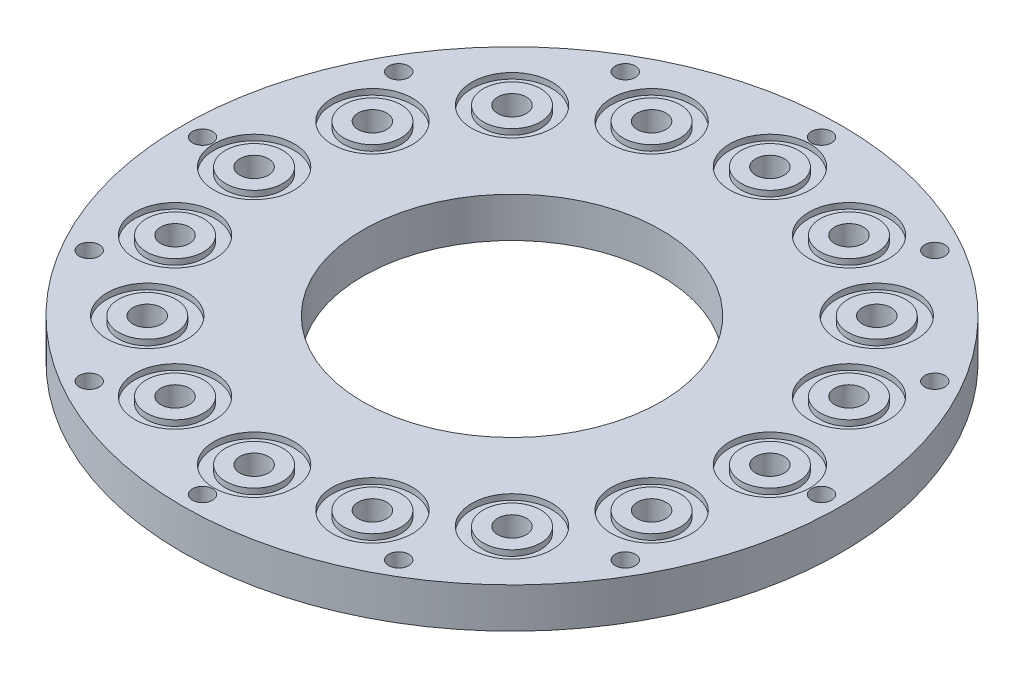
from build123d import *

# Parameters (mm, degrees)
SKETCH1_R           = 57.5
SKETCH1_R_2         = 1.75
SKETCH1_R_3         = 26
SKETCH1_R_4         = 2.5
BOSS_EXTRUDE1_DEPTH = 7
SKETCH2_R           = 7
SKETCH2_R_2         = 5
CUT_EXTRUDE1_DEPTH  = 1


with BuildPart() as part:
    # Sketch1 → Boss-Extrude1 (new body)
    with BuildSketch(Plane(origin=(0, 0, 0), x_dir=(1, 0, 0), z_dir=(0, 1, 0))):
        with Locations(Location((0, 0, 0), (0, 0, 270))):
            Circle(SKETCH1_R)
        with Locations(Location((0, 54, 0), (0, 0, 270))):
            Circle(SKETCH1_R_2, mode=Mode.SUBTRACT)
        with Locations(Location((27, 46.765371804, 0), (0, 0, 270))):
            Circle(SKETCH1_R_2, mode=Mode.SUBTRACT)
        with Locations(Location((46.765371804, 27, 0), (0, 0, 270))):
            Circle(SKETCH1_R_2, mode=Mode.SUBTRACT)
        with Locations(Location((54, 0, 0), (0, 0, 270))):
            Circle(SKETCH1_R_2, mode=Mode.SUBTRACT)
        with Locations(Location((46.765371804, -27, 0), (0, 0, 270))):
            Circle(SKETCH1_R_2, mode=Mode.SUBTRACT)
        with Locations(Location((27, -46.765371804, 0), (0, 0, 270))):
            Circle(SKETCH1_R_2, mode=Mode.SUBTRACT)
        with Locations(Location((0, -54, 0), (0, 0, 270))):
            Circle(SKETCH1_R_2, mode=Mode.SUBTRACT)
        with Locations(Location((-27, -46.765371804, 0), (0, 0, 270))):
            Circle(SKETCH1_R_2, mode=Mode.SUBTRACT)
        with Locations(Location((-46.765371804, -27, 0), (0, 0, 270))):
            Circle(SKETCH1_R_2, mode=Mode.SUBTRACT)
        with Locations(Location((-54, 0, 0), (0, 0, 270))):
            Circle(SKETCH1_R_2, mode=Mode.SUBTRACT)
        with Locations(Location((-46.765371804, 27, 0), (0, 0, 270))):
            Circle(SKETCH1_R_2, mode=Mode.SUBTRACT)
        with Locations(Location((-27, 46.765371804, 0), (0, 0, 270))):
            Circle(SKETCH1_R_2, mode=Mode.SUBTRACT)
        with Locations(Location((0, 0, 0), (0, 0, 270))):
            Circle(SKETCH1_R_3, mode=Mode.SUBTRACT)
        with Locations(Location((0, 45, 0), (0, 0, 270))):
            Circle(SKETCH1_R_4, mode=Mode.SUBTRACT)
        with Locations(Location((17.220754456, 41.574578963, 0), (0, 0, 270))):
            Circle(SKETCH1_R_4, mode=Mode.SUBTRACT)
        with Locations(Location((31.819805153, 31.819805153, 0), (0, 0, 270))):
            Circle(SKETCH1_R_4, mode=Mode.SUBTRACT)
        with Locations(Location((41.574578963, 17.220754456, 0), (0, 0, 270))):
            Circle(SKETCH1_R_4, mode=Mode.SUBTRACT)
        with Locations(Location((45, 0, 0), (0, 0, 270))):
            Circle(SKETCH1_R_4, mode=Mode.SUBTRACT)
        with Locations(Location((41.574578963, -17.220754456, 0), (0, 0, 270))):
            Circle(SKETCH1_R_4, mode=Mode.SUBTRACT)
        with Locations(Location((31.819805153, -31.819805153, 0), (0, 0, 270))):
            Circle(SKETCH1_R_4, mode=Mode.SUBTRACT)
        with Locations(Location((17.220754456, -41.574578963, 0), (0, 0, 270))):
            Circle(SKETCH1_R_4, mode=Mode.SUBTRACT)
        with Locations(Location((0, -45, 0), (0, 0, 270))):
            Circle(SKETCH1_R_4, mode=Mode.SUBTRACT)
        with Locations(Location((-17.220754456, -41.574578963, 0), (0, 0, 270))):
            Circle(SKETCH1_R_4, mode=Mode.SUBTRACT)
        with Locations(Location((-31.819805153, -31.819805153, 0), (0, 0, 270))):
            Circle(SKETCH1_R_4, mode=Mode.SUBTRACT)
        with Locations(Location((-41.574578963, -17.220754456, 0), (0, 0, 270))):
            Circle(SKETCH1_R_4, mode=Mode.SUBTRACT)
        with Locations(Location((-45, 0, 0), (0, 0, 270))):
            Circle(SKETCH1_R_4, mode=Mode.SUBTRACT)
        with Locations(Location((-41.574578963, 17.220754456, 0), (0, 0, 270))):
            Circle(SKETCH1_R_4, mode=Mode.SUBTRACT)
        with Locations(Location((-31.819805153, 31.819805153, 0), (0, 0, 270))):
            Circle(SKETCH1_R_4, mode=Mode.SUBTRACT)
        with Locations(Location((-17.220754456, 41.574578963, 0), (0, 0, 270))):
            Circle(SKETCH1_R_4, mode=Mode.SUBTRACT)
    extrude(amount=BOSS_EXTRUDE1_DEPTH)

    # Sketch2 → Cut-Extrude1 (cut)
    # profile 1 of 16: a face of its own
    with BuildSketch(Plane(origin=(0, 7, 0), x_dir=(1, 0, 0), z_dir=(0, 1, 0))):
        with Locations(Location((0, 45, 0), (0, 0, 270))):
            Circle(SKETCH2_R)
        with Locations(Location((0, 45, 0), (0, 0, 270))):
            Circle(SKETCH2_R_2, mode=Mode.SUBTRACT)
    # profile 2 of 16: a face of its own
    with BuildSketch(Plane(origin=(0, 7, 0), x_dir=(1, 0, 0), z_dir=(0, 1, 0))):
        with Locations(Location((17.220754456, 41.574578963, 0), (0, 0, 270))):
            Circle(SKETCH2_R)
        with Locations(Location((17.220754456, 41.574578963, 0), (0, 0, 270))):
            Circle(SKETCH2_R_2, mode=Mode.SUBTRACT)
    # profile 3 of 16: a face of its own
    with BuildSketch(Plane(origin=(0, 7, 0), x_dir=(1, 0, 0), z_dir=(0, 1, 0))):
        with Locations(Location((31.819805153, 31.819805153, 0), (0, 0, 270))):
            Circle(SKETCH2_R)
        with Locations(Location((31.819805153, 31.819805153, 0), (0, 0, 270))):
            Circle(SKETCH2_R_2, mode=Mode.SUBTRACT)
    # profile 4 of 16: a face of its own
    with BuildSketch(Plane(origin=(0, 7, 0), x_dir=(1, 0, 0), z_dir=(0, 1, 0))):
        with Locations(Location((41.574578963, 17.220754456, 0), (0, 0, 270))):
            Circle(SKETCH2_R)
        with Locations(Location((41.574578963, 17.220754456, 0), (0, 0, 270))):
            Circle(SKETCH2_R_2, mode=Mode.SUBTRACT)
    # profile 5 of 16: a face of its own
    with BuildSketch(Plane(origin=(0, 7, 0), x_dir=(1, 0, 0), z_dir=(0, 1, 0))):
        with Locations(Location((45, 0, 0), (0, 0, 270))):
            Circle(SKETCH2_R)
        with Locations(Location((45, 0, 0), (0, 0, 270))):
            Circle(SKETCH2_R_2, mode=Mode.SUBTRACT)
    # profile 6 of 16: a face of its own
    with BuildSketch(Plane(origin=(0, 7, 0), x_dir=(1, 0, 0), z_dir=(0, 1, 0))):
        with Locations(Location((41.574578963, -17.220754456, 0), (0, 0, 270))):
            Circle(SKETCH2_R)
        with Locations(Location((41.574578963, -17.220754456, 0), (0, 0, 270))):
            Circle(SKETCH2_R_2, mode=Mode.SUBTRACT)
    # profile 7 of 16: a face of its own
    with BuildSketch(Plane(origin=(0, 7, 0), x_dir=(1, 0, 0), z_dir=(0, 1, 0))):
        with Locations(Location((31.819805153, -31.819805153, 0), (0, 0, 270))):
            Circle(SKETCH2_R)
        with Locations(Location((31.819805153, -31.819805153, 0), (0, 0, 270))):
            Circle(SKETCH2_R_2, mode=Mode.SUBTRACT)
    # profile 8 of 16: a face of its own
    with BuildSketch(Plane(origin=(0, 7, 0), x_dir=(1, 0, 0), z_dir=(0, 1, 0))):
        with Locations(Location((17.220754456, -41.574578963, 0), (0, 0, 270))):
            Circle(SKETCH2_R)
        with Locations(Location((17.220754456, -41.574578963, 0), (0, 0, 270))):
            Circle(SKETCH2_R_2, mode=Mode.SUBTRACT)
    # profile 9 of 16: a face of its own
    with BuildSketch(Plane(origin=(0, 7, 0), x_dir=(1, 0, 0), z_dir=(0, 1, 0))):
        with Locations(Location((0, -45, 0), (0, 0, 270))):
            Circle(SKETCH2_R)
        with Locations(Location((0, -45, 0), (0, 0, 270))):
            Circle(SKETCH2_R_2, mode=Mode.SUBTRACT)
    # profile 10 of 16: a face of its own
    with BuildSketch(Plane(origin=(0, 7, 0), x_dir=(1, 0, 0), z_dir=(0, 1, 0))):
        with Locations(Location((-17.220754456, -41.574578963, 0), (0, 0, 270))):
            Circle(SKETCH2_R)
        with Locations(Location((-17.220754456, -41.574578963, 0), (0, 0, 270))):
            Circle(SKETCH2_R_2, mode=Mode.SUBTRACT)
    # profile 11 of 16: a face of its own
    with BuildSketch(Plane(origin=(0, 7, 0), x_dir=(1, 0, 0), z_dir=(0, 1, 0))):
        with Locations(Location((-31.819805153, -31.819805153, 0), (0, 0, 270))):
            Circle(SKETCH2_R)
        with Locations(Location((-31.819805153, -31.819805153, 0), (0, 0, 270))):
            Circle(SKETCH2_R_2, mode=Mode.SUBTRACT)
    # profile 12 of 16: a face of its own
    with BuildSketch(Plane(origin=(0, 7, 0), x_dir=(1, 0, 0), z_dir=(0, 1, 0))):
        with Locations(Location((-41.574578963, -17.220754456, 0), (0, 0, 270))):
            Circle(SKETCH2_R)
        with Locations(Location((-41.574578963, -17.220754456, 0), (0, 0, 270))):
            Circle(SKETCH2_R_2, mode=Mode.SUBTRACT)
    # profile 13 of 16: a face of its own
    with BuildSketch(Plane(origin=(0, 7, 0), x_dir=(1, 0, 0), z_dir=(0, 1, 0))):
        with Locations(Location((-45, 0, 0), (0, 0, 270))):
            Circle(SKETCH2_R)
        with Locations(Location((-45, 0, 0), (0, 0, 270))):
            Circle(SKETCH2_R_2, mode=Mode.SUBTRACT)
    # profile 14 of 16: a face of its own
    with BuildSketch(Plane(origin=(0, 7, 0), x_dir=(1, 0, 0), z_dir=(0, 1, 0))):
        with Locations(Location((-41.574578963, 17.220754456, 0), (0, 0, 270))):
            Circle(SKETCH2_R)
        with Locations(Location((-41.574578963, 17.220754456, 0), (0, 0, 270))):
            Circle(SKETCH2_R_2, mode=Mode.SUBTRACT)
    # profile 15 of 16: a face of its own
    with BuildSketch(Plane(origin=(0, 7, 0), x_dir=(1, 0, 0), z_dir=(0, 1, 0))):
        with Locations(Location((-31.819805153, 31.819805153, 0), (0, 0, 270))):
            Circle(SKETCH2_R)
        with Locations(Location((-31.819805153, 31.819805153, 0), (0, 0, 270))):
            Circle(SKETCH2_R_2, mode=Mode.SUBTRACT)
    # profile 16 of 16: a face of its own
    with BuildSketch(Plane(origin=(0, 7, 0), x_dir=(1, 0, 0), z_dir=(0, 1, 0))):
        with Locations(Location((-17.220754456, 41.574578963, 0), (0, 0, 270))):
            Circle(SKETCH2_R)
        with Locations(Location((-17.220754456, 41.574578963, 0), (0, 0, 270))):
            Circle(SKETCH2_R_2, mode=Mode.SUBTRACT)
    extrude(amount=-CUT_EXTRUDE1_DEPTH, mode=Mode.SUBTRACT)


solid = part.part
